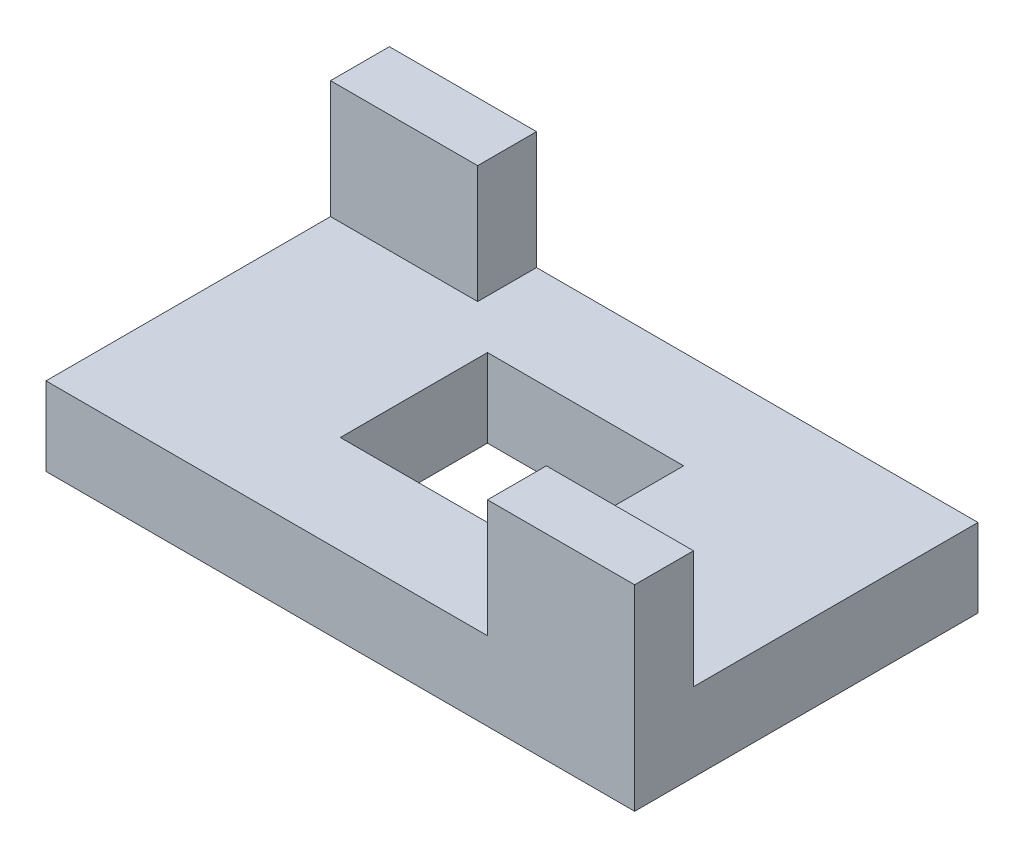
from build123d import *

# Parameters (mm, degrees)
SKETCH1_W           = 60
SKETCH1_H           = 35
BOSS_EXTRUDE1_DEPTH = 8
SKETCH2_W           = 20
SKETCH2_H           = 15
CUT_EXTRUDE1_DEPTH  = 36.640566774
SKETCH3_W           = 15
SKETCH3_H           = 6
BOSS_EXTRUDE2_DEPTH = 20


with BuildPart() as part:
    # Sketch1 → Boss-Extrude1 (new body)
    with BuildSketch(Plane(origin=(0, 0, 0), x_dir=(1, 0, 0), z_dir=(0, 1, 0))):
        Rectangle(SKETCH1_W, SKETCH1_H)
    extrude(amount=BOSS_EXTRUDE1_DEPTH)

    # Sketch2 → Cut-Extrude1 (cut, through all)
    with BuildSketch(Plane(origin=(0, 0, 0), x_dir=(1, 0, 0), z_dir=(0, 1, 0))):
        Rectangle(SKETCH2_W, SKETCH2_H)
    extrude(amount=CUT_EXTRUDE1_DEPTH, mode=Mode.SUBTRACT)

    # Sketch3 → Boss-Extrude2 (add)
    with BuildSketch(Plane(origin=(0, 0, 0), x_dir=(1, 0, 0), z_dir=(0, 1, 0))):
        with Locations((22.5, -14.5)):
            Rectangle(SKETCH3_W, SKETCH3_H)
        with Locations((-22.5, 14.5)):
            Rectangle(SKETCH3_W, SKETCH3_H)
    extrude(amount=BOSS_EXTRUDE2_DEPTH)


solid = part.part
